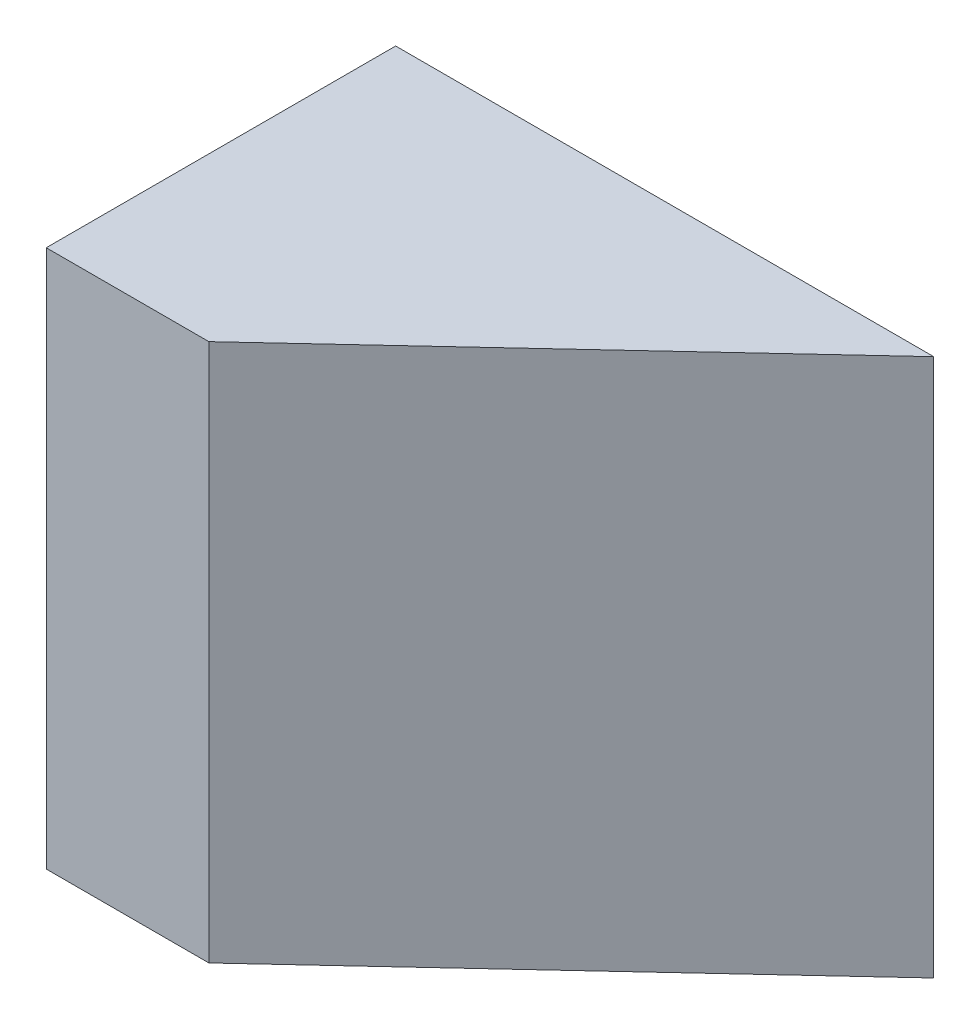
from build123d import *

# Parameters (mm, degrees)
ESQUISSE1_W             = 154
ESQUISSE1_H             = 154
BOSS_EXTRU_1_DEPTH      = 100
ENL_V_MAT_EXTRU_1_DEPTH = 200.110522073
COQUE2_T                = -3


with BuildPart() as part:
    # Esquisse1 → Boss.-Extru.1 (new body)
    with BuildSketch(Plane.XY):
        Rectangle(ESQUISSE1_W, ESQUISSE1_H)
    extrude(amount=BOSS_EXTRU_1_DEPTH)

    # Esquisse2 → Enlèv. mat.-Extru.1 (cut, through all)
    with BuildSketch(Plane.XZ.offset(77)):
        Polygon((-30.458383107, 100), (77, 0), (77, 100), align=None)
    extrude(amount=-ENL_V_MAT_EXTRU_1_DEPTH, mode=Mode.SUBTRACT)

    # Coque2
    coque2_openings = [part.faces().sort_by_distance(p)[0] for p in [
        (0, 0, 0),
    ]]
    offset(amount=COQUE2_T, openings=coque2_openings, kind=Kind.INTERSECTION)


solid = part.part
